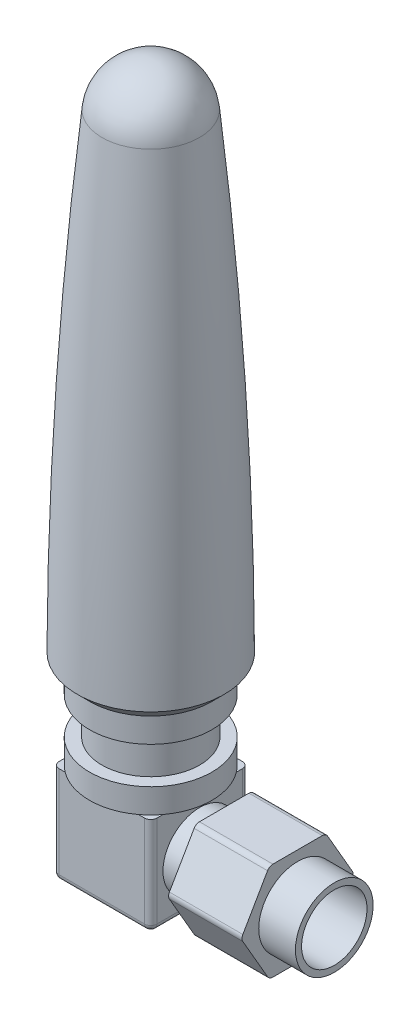
from build123d import *

# Parameters (mm, degrees)
SKETCH_2_W          = 8
SKETCH_2_H          = 8
EXTRUDE_1_DEPTH     = 8
SKETCH_4_R          = 5
CUT_EXTRUDE_1_DEPTH = 6
FILLET_1_R          = 0.5


with BuildPart() as part:
    # 草图1 → 旋转1 (revolve)
    with BuildSketch(Plane.XY, mode=Mode.PRIVATE) as revolve_1_sk:
        with BuildLine():
            Line((0, 0), (5, 0))
            Line((5, 0), (5, 2))
            Line((5, 2), (4, 2))
            Line((4, 2), (4, 5))
            Line((4, 5), (5, 5))
            Line((5, 5), (5, 7))
            Line((5, 7), (6, 8))
            ThreePointArc((6, 8), (5.451628729, 27.225245427), (3.979757576, 46.401907496))
            ThreePointArc((3.979757576, 46.401907496), (2.682570597, 48.967122342), (0, 50))
            Line((0, 50), (0, 0))
        make_face()
    revolve(revolve_1_sk.sketch.rotate(Axis((0, -56.22118461, 0), (0, 1, 0)), 90), axis=Axis((0, -56.22118461, 0), (0, 1, 0)))

    # 草图2 → 凸台-拉伸1 (add)
    with BuildSketch(Plane.XZ):
        Rectangle(SKETCH_2_W, SKETCH_2_H)
    extrude(amount=EXTRUDE_1_DEPTH)

    # 草图3 → 旋转2 (revolve)
    with BuildSketch(Plane.XY, mode=Mode.PRIVATE) as revolve_2_sk:
        with BuildLine():
            Line((4, -4), (4, -1))
            Line((4, -1), (6, -1))
            Line((6, -1), (6, 1))
            Line((6, 1), (12, 1))
            Line((12, 1), (12, -0.825))
            Line((12, -0.825), (15, -0.825))
            Line((15, -0.825), (15, -1.325))
            Line((15, -1.325), (7, -1.325))
            Line((7, -1.325), (7, -3.6))
            Line((7, -3.6), (12, -3.6))
            ThreePointArc((12, -3.6), (12.282842712, -3.717157288), (12.4, -4))
            Line((12.4, -4), (4, -4))
        make_face()
    revolve(revolve_2_sk.sketch.rotate(Axis((-4, -4, 0), (1, 0, 0)), 90), axis=Axis((-4, -4, 0), (1, 0, 0)))

    # 草图4 → 切除-拉伸1 (cut)
    with BuildSketch(Plane(origin=(12, 0, 0), x_dir=(0, 0, -1), z_dir=(1, 0, 0))):
        with Locations((0, -4)):
            Circle(SKETCH_4_R)
        Polygon((2.309401077, 0), (-2.309401077, 0), (-4.618802154, -4), (-2.309401077, -8), (2.309401077, -8), (4.618802154, -4), align=None, mode=Mode.SUBTRACT)
    extrude(amount=-CUT_EXTRUDE_1_DEPTH, mode=Mode.SUBTRACT)

    # 圆角1
    fillet_1_edges = [part.edges().sort_by_distance(p)[0] for p in [
        (4, -4, -4),
        (4, -4, 4),
        (-4, -4, 4),
        (-4, -4, -4),
        (4, -8, 0),
        (0, -8, 4),
        (-4, -8, 0),
        (0, -8, -4),
        (9, 0, -2.309401077),
        (9, 0, 2.309401077),
        (9, -4, 4.618802154),
        (9, -8, 2.309401077),
        (9, -8, -2.309401077),
        (9, -4, -4.618802154),
    ]]
    fillet(fillet_1_edges, radius=FILLET_1_R)


solid = part.part
